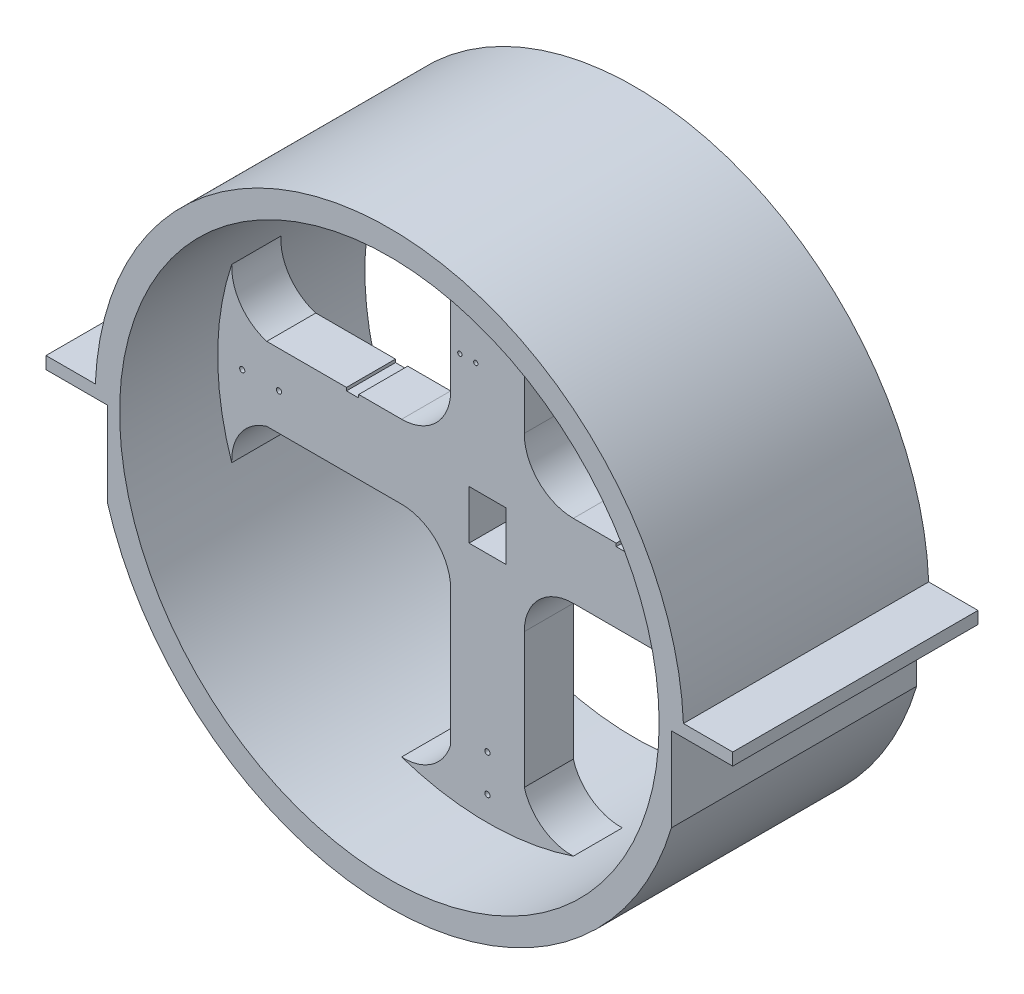
from build123d import *

# Parameters (mm, degrees)
SKETCH1_R               = 152.4
SKETCH1_R_2             = 139.7
BOSS_EXTRUDE1_DEPTH     = 63.5
BOSS_EXTRUDE2_DEPTH     = 12.7
CUT_EXTRUDE3_DEPTH      = 225.685936365
CUT_EXTRUDE3_DEPTH_BACK = 225.685936365
SKETCH4_W               = 19.05
SKETCH4_H               = 19.05
SKETCH7_W               = 19.05
SKETCH7_H               = 6.35
CUT_EXTRUDE4_DEPTH      = 229.6
SKETCH8_W               = 17.202693119
SKETCH8_H               = 50.8
CUT_EXTRUDE5_DEPTH      = 251.160988166
SKETCH9_W               = 31.75
SKETCH9_H               = 6.35
BOSS_EXTRUDE3_DEPTH     = 127
SKETCH10_W              = 6.35
SKETCH10_H              = 1.5875
CUT_EXTRUDE6_DEPTH      = 247.262136757
F_4_40_TAPPED_HOLE1_D   = 2.2606
F_6_32_TAPPED_HOLE1_D   = 2.7051
CIRPATTERN1_COUNT       = 4


with BuildPart() as part:
    # Sketch1 → Boss-Extrude1 (new, symmetric)
    with BuildSketch(Plane.XY):
        Circle(SKETCH1_R)
        Circle(SKETCH1_R_2, mode=Mode.SUBTRACT)
    extrude(amount=BOSS_EXTRUDE1_DEPTH, both=True)

    # Sketch2 → Boss-Extrude2 (add, symmetric)
    with BuildSketch(Plane.XY):
        with BuildLine():
            ThreePointArc((-114.3, 19.05), (-127.736482233, 28.655491493), (-132.425396447, 44.492745205))
            Line((-132.425396447, 44.492745205), (-143.350279695, 19.05))
            Line((-143.350279695, 19.05), (-147.191797275, 19.05))
            Line((-147.191797275, 19.05), (-147.191797275, -19.05))
            Line((-147.191797275, -19.05), (-143.95681272, -19.05))
            Line((-143.95681272, -19.05), (-132.439750453, -44.45))
            ThreePointArc((-132.439750453, -44.45), (-127.731621931, -28.635000127), (-114.3, -19.05))
            Line((-114.3, -19.05), (-44.45, -19.05))
            ThreePointArc((-44.45, -19.05), (-26.489487758, -26.489487758), (-19.05, -44.45))
            Line((-19.05, -44.45), (-19.05, -114.3))
            ThreePointArc((-19.05, -114.3), (-28.655491493, -127.736482233), (-44.492745205, -132.425396447))
            Line((-44.492745205, -132.425396447), (-19.05, -143.350279695))
            Line((-19.05, -143.350279695), (-19.05, -143.95681272))
            Line((-19.05, -143.95681272), (19.05, -143.95681272))
            Line((19.05, -143.95681272), (44.45, -132.439750453))
            ThreePointArc((44.45, -132.439750453), (28.635000127, -127.731621931), (19.05, -114.3))
            Line((19.05, -114.3), (19.05, -44.45))
            ThreePointArc((19.05, -44.45), (26.489487758, -26.489487758), (44.45, -19.05))
            Line((44.45, -19.05), (114.3, -19.05))
            ThreePointArc((114.3, -19.05), (127.736482233, -28.655491493), (132.425396447, -44.492745205))
            Line((132.425396447, -44.492745205), (143.350279695, -19.05))
            Line((143.350279695, -19.05), (147.191797275, -19.05))
            Line((147.191797275, -19.05), (147.191797275, 19.05))
            Line((147.191797275, 19.05), (143.95681272, 19.05))
            Line((143.95681272, 19.05), (132.439750453, 44.45))
            ThreePointArc((132.439750453, 44.45), (127.731621931, 28.635000127), (114.3, 19.05))
            Line((114.3, 19.05), (44.45, 19.05))
            ThreePointArc((44.45, 19.05), (26.489487758, 26.489487758), (19.05, 44.45))
            Line((19.05, 44.45), (19.05, 114.3))
            ThreePointArc((19.05, 114.3), (28.655491493, 127.736482233), (44.492745205, 132.425396447))
            Line((44.492745205, 132.425396447), (19.05, 143.350279695))
            Line((19.05, 143.350279695), (19.05, 143.95681272))
            Line((19.05, 143.95681272), (-19.05, 143.95681272))
            Line((-19.05, 143.95681272), (-44.45, 132.439750453))
            ThreePointArc((-44.45, 132.439750453), (-28.635000127, 127.731621931), (-19.05, 114.3))
            Line((-19.05, 114.3), (-19.05, 44.45))
            ThreePointArc((-19.05, 44.45), (-26.489487758, 26.489487758), (-44.45, 19.05))
            Line((-44.45, 19.05), (-114.3, 19.05))
        make_face()
    extrude(amount=BOSS_EXTRUDE2_DEPTH, both=True)

    # Sketch4 → Cut-Extrude3 (cut, two sides: drawn at the far end of the back side and taken through both)
    with BuildSketch(Plane.XY.offset(-CUT_EXTRUDE3_DEPTH_BACK)):
        with Locations((0, -9.525)):
            Rectangle(SKETCH4_W, SKETCH4_H)
    extrude(amount=CUT_EXTRUDE3_DEPTH + CUT_EXTRUDE3_DEPTH_BACK, mode=Mode.SUBTRACT)

    # Sketch7 → Cut-Extrude4 (cut, through all)
    with BuildSketch(Plane.XY.offset(12.7)):
        with Locations((0, 3.175)):
            Rectangle(SKETCH7_W, SKETCH7_H)
    extrude(amount=-CUT_EXTRUDE4_DEPTH, mode=Mode.SUBTRACT)

    # Sketch8 → Cut-Extrude5 (cut, through all)
    with BuildSketch(Plane.XY.offset(63.5)):
        with Locations((-154.65134656, -25.4)):
            Rectangle(SKETCH8_W, SKETCH8_H)
    cut_extrude5 = extrude(amount=-CUT_EXTRUDE5_DEPTH, mode=Mode.SUBTRACT)

    # Mirror1: Cut-Extrude5 across plane
    add(cut_extrude5.mirror(Plane(origin=(0, 0, 0), x_dir=(0, 0, 1), z_dir=(1, 0, 0))), mode=Mode.SUBTRACT)

    # Sketch9 → Boss-Extrude3 (add)
    with BuildSketch(Plane.XY.offset(63.5)):
        with Locations((161.925, 3.175)):
            Rectangle(SKETCH9_W, SKETCH9_H)
    boss_extrude3 = extrude(amount=-BOSS_EXTRUDE3_DEPTH)

    # Mirror2: Boss-Extrude3 across plane
    add(boss_extrude3.mirror(Plane(origin=(0, 0, 0), x_dir=(0, 0, 1), z_dir=(1, 0, 0))))

    # Sketch10 → Cut-Extrude6 (cut, through all)
    with BuildSketch(Plane.XY.offset(12.7)):
        with Locations((-69.85, 18.25625)):
            Rectangle(SKETCH10_W, SKETCH10_H)
    cut_extrude6 = extrude(amount=-CUT_EXTRUDE6_DEPTH, mode=Mode.SUBTRACT)

    # Mirror3: Cut-Extrude6 across plane
    add(cut_extrude6.mirror(Plane(origin=(0, 0, 0), x_dir=(0, 0, 1), z_dir=(1, 0, 0))), mode=Mode.SUBTRACT)

    # #4-40 Tapped Hole1 (through all)
    with Locations(Plane.XY.offset(12.7)):
        with Locations((-14.2875, 63.5), (-6.0325, 63.5), (88.9, 14.2875), (88.9, 6.0325)):
            Hole(F_4_40_TAPPED_HOLE1_D / 2)

    # #6-32 Tapped Hole1 (through all)
    with Locations(Plane.XY.offset(12.7)):
        with Locations((-107.95, 0), (-127, 0)):
            f_6_32_tapped_hole1 = Hole(F_6_32_TAPPED_HOLE1_D / 2)

    # CirPattern1: #6-32 Tapped Hole1 ×4 about axis
    cirpattern1_axis = Axis((0, 0, 0), (0, 0, 1))
    for i in range(1, CIRPATTERN1_COUNT):
        add(f_6_32_tapped_hole1.rotate(cirpattern1_axis, i * 360 / CIRPATTERN1_COUNT), mode=Mode.SUBTRACT)


solid = part.part
